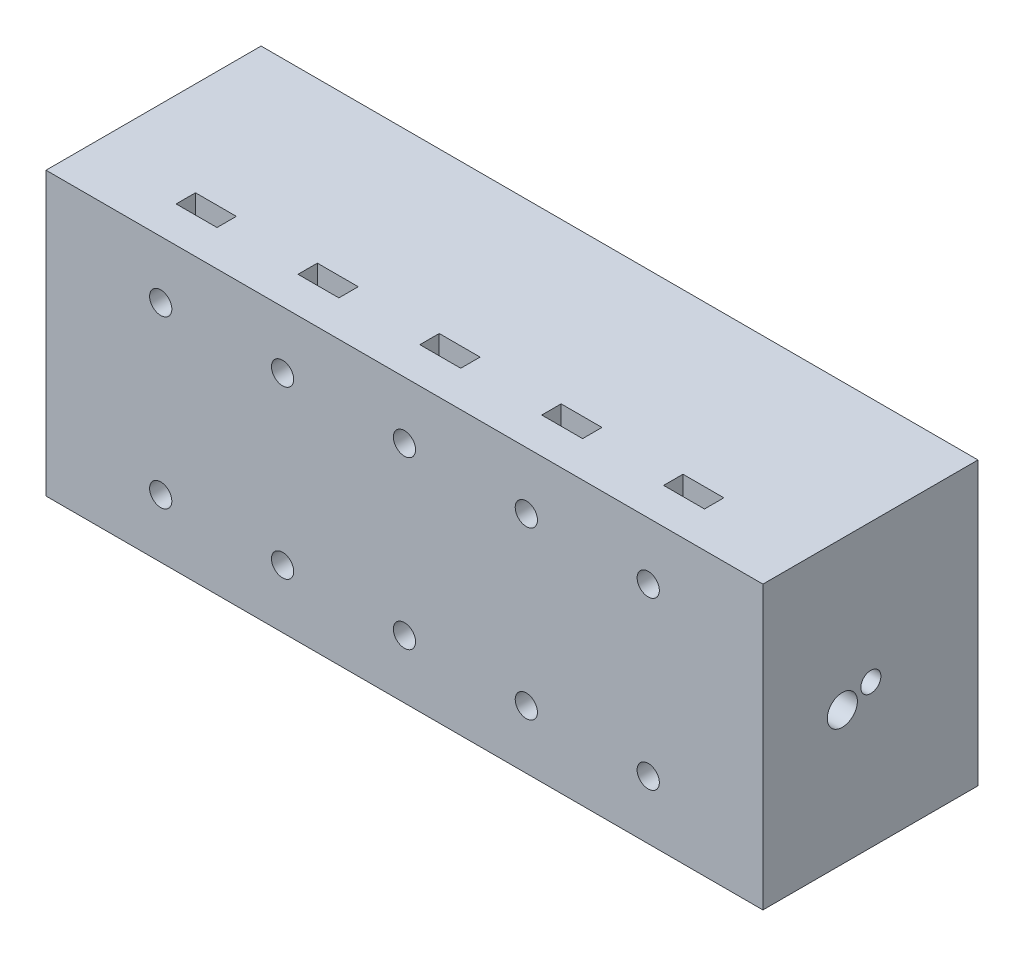
from build123d import *

# Parameters (mm, degrees)
SKIZZE2_W                            = 100
SKIZZE2_H                            = 39.364160046
AUFSATZ_LINEAR_AUSTRAGEN1_DEPTH      = 30
SCHNITT_LINEAR_AUSTRAGEN1_DEPTH      = 40
SCHNITT_LINEAR_AUSTRAGEN1_DEPTH_BACK = 40
SKIZZE10_R                           = 5
SKIZZE17_R                           = 1.4
SCHNITT_LINEAR_AUSTRAGEN2_DEPTH      = 103.710939516
SKIZZE24_R                           = 1.55
SCHNITT_LINEAR_AUSTRAGEN4_DEPTH      = 112.577493681
SKIZZE37_R                           = 0.736865544
SCHNITT_LINEAR_AUSTRAGEN9_DEPTH      = 112.577493681
SKIZZE40_R                           = 2.1
SCHNITT_LINEAR_AUSTRAGEN10_DEPTH     = 6
SKIZZE42_R                           = 0.75
SCHNITT_LINEAR_AUSTRAGEN12_DEPTH     = 10
VERRUNDUNG1_R                        = 1
SKIZZE46_R                           = 2.85
SCHNITT_LINEAR_AUSTRAGEN15_DEPTH     = 10
SCHNITT_LINEAR_START                 = -5
SCHNITT_LINEAR_AUSTRAGEN25_DEPTH     = 2.7
LINEARES_MUSTER1_COUNT               = 5
LINEARES_MUSTER1_PITCH               = 17
SPIEGELN2_COPY_1_SKETCH_R            = 2.85
SPIEGELN2_COPY_1_DEPTH               = 10
SPIEGELN2_COPY_2_SKETCH_R            = 2.85
SPIEGELN2_COPY_2_DEPTH               = 10
SPIEGELN2_COPY_3_SKETCH_R            = 2.85
SPIEGELN2_COPY_3_DEPTH               = 10
SPIEGELN2_COPY_4_SKETCH_R            = 2.85
SPIEGELN2_COPY_4_DEPTH               = 10
SPIEGELN2_START                      = -5
SPIEGELN2_COPY_5_DEPTH               = 2.7
SPIEGELN2_COPY_6_DEPTH               = 2.7
SPIEGELN2_COPY_7_DEPTH               = 2.7
SPIEGELN2_COPY_8_DEPTH               = 2.7
SCHNITT_LINEAR_START_2               = -10
SKIZZE51_R                           = 1.55
SCHNITT_LINEAR_AUSTRAGEN26_DEPTH     = 10


with BuildPart() as part:
    # Skizze2 → Aufsatz-Linear austragen1 (new body)
    with BuildSketch(Plane.XY):
        with Locations((50, 19.682080023)):
            Rectangle(SKIZZE2_W, SKIZZE2_H)
    extrude(amount=AUFSATZ_LINEAR_AUSTRAGEN1_DEPTH)

    # Skizze10 → Schnitt-Linear austragen1 (cut, two sides: drawn at the far end of the back side and taken through both)
    with BuildSketch(Plane.ZY.offset(-50).offset(-SCHNITT_LINEAR_AUSTRAGEN1_DEPTH_BACK)):
        with Locations((14.945770016, 20.027045739)):
            Circle(SKIZZE10_R)
    extrude(amount=SCHNITT_LINEAR_AUSTRAGEN1_DEPTH + SCHNITT_LINEAR_AUSTRAGEN1_DEPTH_BACK, mode=Mode.SUBTRACT)

    # Skizze17 → Schnitt-Linear austragen2 (cut, through all)
    with BuildSketch(Plane.ZY.offset(-90)):
        with Locations((14.945770016, 20.027045739)):
            Circle(SKIZZE17_R)
    schnitt_linear_austragen2 = extrude(amount=-SCHNITT_LINEAR_AUSTRAGEN2_DEPTH, mode=Mode.SUBTRACT)

    # Spiegeln1: Schnitt-Linear austragen2 across plane
    add(schnitt_linear_austragen2.mirror(Plane.ZY.offset(-50)), mode=Mode.SUBTRACT)

    # Skizze24 → Schnitt-Linear austragen4 (cut, through all)
    with BuildSketch(Plane.XY.offset(30)):
        with Locations((16, 31.364160046)):
            Circle(SKIZZE24_R)
        with Locations((33, 31.364160046)):
            Circle(SKIZZE24_R)
        with Locations((50, 31.364160046)):
            Circle(SKIZZE24_R)
        with Locations((67, 31.364160046)):
            Circle(SKIZZE24_R)
        with Locations((84, 31.364160046)):
            Circle(SKIZZE24_R)
    schnitt_linear_austragen4 = extrude(amount=-SCHNITT_LINEAR_AUSTRAGEN4_DEPTH, mode=Mode.SUBTRACT)

    # Skizze37 → Schnitt-Linear austragen9 (cut, through all)
    with BuildSketch(Plane(origin=(100, 0, 0), x_dir=(0, 0, -1), z_dir=(1, 0, 0))):
        with Locations((-18.924590299, 18.633559666)):
            Circle(SKIZZE37_R)
    extrude(amount=-SCHNITT_LINEAR_AUSTRAGEN9_DEPTH, mode=Mode.SUBTRACT)

    # Skizze40 → Schnitt-Linear austragen10 (cut)
    with BuildSketch(Plane(origin=(100, 0, 0), x_dir=(0, 0, -1), z_dir=(1, 0, 0))):
        with Locations((-18.924590299, 18.633559666)):
            Circle(SKIZZE40_R)
    extrude(amount=-SCHNITT_LINEAR_AUSTRAGEN10_DEPTH, mode=Mode.SUBTRACT)

    # Skizze42 → Schnitt-Linear austragen12 (cut)
    with BuildSketch(Plane.ZY):
        with Locations((10.86415918, 18.842582577)):
            Circle(SKIZZE42_R)
    extrude(amount=-SCHNITT_LINEAR_AUSTRAGEN12_DEPTH, mode=Mode.SUBTRACT)

    # Verrundung1
    verrundung1_edges = [part.edges().sort_by_distance(p)[0] for p in [
        (94, 18.633559666, 19.661455843),
    ]]
    fillet(verrundung1_edges, radius=VERRUNDUNG1_R)

    # Skizze46 → Schnitt-Linear austragen15 (cut)
    with BuildSketch(Plane(origin=(0, 0, 0), x_dir=(-1, 0, 0), z_dir=(0, 0, -1))):
        with Locations((-84, 31.364160046)):
            Circle(SKIZZE46_R)
    schnitt_linear_austragen15 = extrude(amount=-SCHNITT_LINEAR_AUSTRAGEN15_DEPTH, mode=Mode.SUBTRACT)

    # Skizze50 → Schnitt-Linear austragen25 (cut)
    with BuildSketch(Plane.XY.offset(30).offset(SCHNITT_LINEAR_START)):
        Polygon((81.15, 33.009608314), (81.15, 39.364160046), (86.85, 39.364160046), (86.85, 33.009608314), (86.85, 29.718711779), (84, 28.073263512), (81.15, 29.718711779), align=None)
    schnitt_linear_austragen25 = extrude(amount=-SCHNITT_LINEAR_AUSTRAGEN25_DEPTH, mode=Mode.SUBTRACT)

    # Lineares Muster1: Schnitt-Linear austragen15, Schnitt-Linear austragen25 ×5
    with Locations(*[(-i * LINEARES_MUSTER1_PITCH, 0, 0) for i in range(1, LINEARES_MUSTER1_COUNT)]):
        add(schnitt_linear_austragen15, mode=Mode.SUBTRACT)
        add(schnitt_linear_austragen25, mode=Mode.SUBTRACT)

    # Spiegeln2: Schnitt-Linear austragen15, Schnitt-Linear austragen25 across plane
    add(schnitt_linear_austragen15.mirror(Plane.ZX.offset(19.764160046)), mode=Mode.SUBTRACT)
    add(schnitt_linear_austragen25.mirror(Plane.ZX.offset(19.764160046)), mode=Mode.SUBTRACT)

    # Spiegeln2 copy 1 sketch → Spiegeln2 copy 1 (cut)
    with BuildSketch(Plane(origin=(-17, 39.528320093, 0), x_dir=(-1, 0, 0), z_dir=(0, 0, -1))):
        with Locations((-84, -31.364160046)):
            Circle(SPIEGELN2_COPY_1_SKETCH_R)
    extrude(amount=-SPIEGELN2_COPY_1_DEPTH, mode=Mode.SUBTRACT)

    # Spiegeln2 copy 2 sketch → Spiegeln2 copy 2 (cut)
    with BuildSketch(Plane(origin=(-34, 39.528320093, 0), x_dir=(-1, 0, 0), z_dir=(0, 0, -1))):
        with Locations((-84, -31.364160046)):
            Circle(SPIEGELN2_COPY_2_SKETCH_R)
    extrude(amount=-SPIEGELN2_COPY_2_DEPTH, mode=Mode.SUBTRACT)

    # Spiegeln2 copy 3 sketch → Spiegeln2 copy 3 (cut)
    with BuildSketch(Plane(origin=(-51, 39.528320093, 0), x_dir=(-1, 0, 0), z_dir=(0, 0, -1))):
        with Locations((-84, -31.364160046)):
            Circle(SPIEGELN2_COPY_3_SKETCH_R)
    extrude(amount=-SPIEGELN2_COPY_3_DEPTH, mode=Mode.SUBTRACT)

    # Spiegeln2 copy 4 sketch → Spiegeln2 copy 4 (cut)
    with BuildSketch(Plane(origin=(-68, 39.528320093, 0), x_dir=(-1, 0, 0), z_dir=(0, 0, -1))):
        with Locations((-84, -31.364160046)):
            Circle(SPIEGELN2_COPY_4_SKETCH_R)
    extrude(amount=-SPIEGELN2_COPY_4_DEPTH, mode=Mode.SUBTRACT)

    # Spiegeln2 copy 5 sketch → Spiegeln2 copy 5 (cut)
    with BuildSketch(Plane(origin=(-17, 39.528320093, 30), x_dir=(1, 0, 0), z_dir=(0, 0, 1)).offset(SPIEGELN2_START)):
        Polygon((81.15, -33.009608314), (81.15, -39.364160046), (86.85, -39.364160046), (86.85, -33.009608314), (86.85, -29.718711779), (84, -28.073263512), (81.15, -29.718711779), align=None)
    extrude(amount=-SPIEGELN2_COPY_5_DEPTH, mode=Mode.SUBTRACT)

    # Spiegeln2 copy 6 sketch → Spiegeln2 copy 6 (cut)
    with BuildSketch(Plane(origin=(-34, 39.528320093, 30), x_dir=(1, 0, 0), z_dir=(0, 0, 1)).offset(SPIEGELN2_START)):
        Polygon((81.15, -33.009608314), (81.15, -39.364160046), (86.85, -39.364160046), (86.85, -33.009608314), (86.85, -29.718711779), (84, -28.073263512), (81.15, -29.718711779), align=None)
    extrude(amount=-SPIEGELN2_COPY_6_DEPTH, mode=Mode.SUBTRACT)

    # Spiegeln2 copy 7 sketch → Spiegeln2 copy 7 (cut)
    with BuildSketch(Plane(origin=(-51, 39.528320093, 30), x_dir=(1, 0, 0), z_dir=(0, 0, 1)).offset(SPIEGELN2_START)):
        Polygon((81.15, -33.009608314), (81.15, -39.364160046), (86.85, -39.364160046), (86.85, -33.009608314), (86.85, -29.718711779), (84, -28.073263512), (81.15, -29.718711779), align=None)
    extrude(amount=-SPIEGELN2_COPY_7_DEPTH, mode=Mode.SUBTRACT)

    # Spiegeln2 copy 8 sketch → Spiegeln2 copy 8 (cut)
    with BuildSketch(Plane(origin=(-68, 39.528320093, 30), x_dir=(1, 0, 0), z_dir=(0, 0, 1)).offset(SPIEGELN2_START)):
        Polygon((81.15, -33.009608314), (81.15, -39.364160046), (86.85, -39.364160046), (86.85, -33.009608314), (86.85, -29.718711779), (84, -28.073263512), (81.15, -29.718711779), align=None)
    extrude(amount=-SPIEGELN2_COPY_8_DEPTH, mode=Mode.SUBTRACT)

    # Spiegeln3: Schnitt-Linear austragen4 across plane
    add(schnitt_linear_austragen4.mirror(Plane.ZX.offset(19.764160046)), mode=Mode.SUBTRACT)

    # Skizze51 → Schnitt-Linear austragen26 (cut)
    with BuildSketch(Plane.XY.offset(30).offset(SCHNITT_LINEAR_START_2)):
        with Locations((5, 34.364160046)):
            Circle(SKIZZE51_R)
        with Locations((95, 5)):
            Circle(SKIZZE51_R)
    extrude(amount=-SCHNITT_LINEAR_AUSTRAGEN26_DEPTH, mode=Mode.SUBTRACT)


solid = part.part
